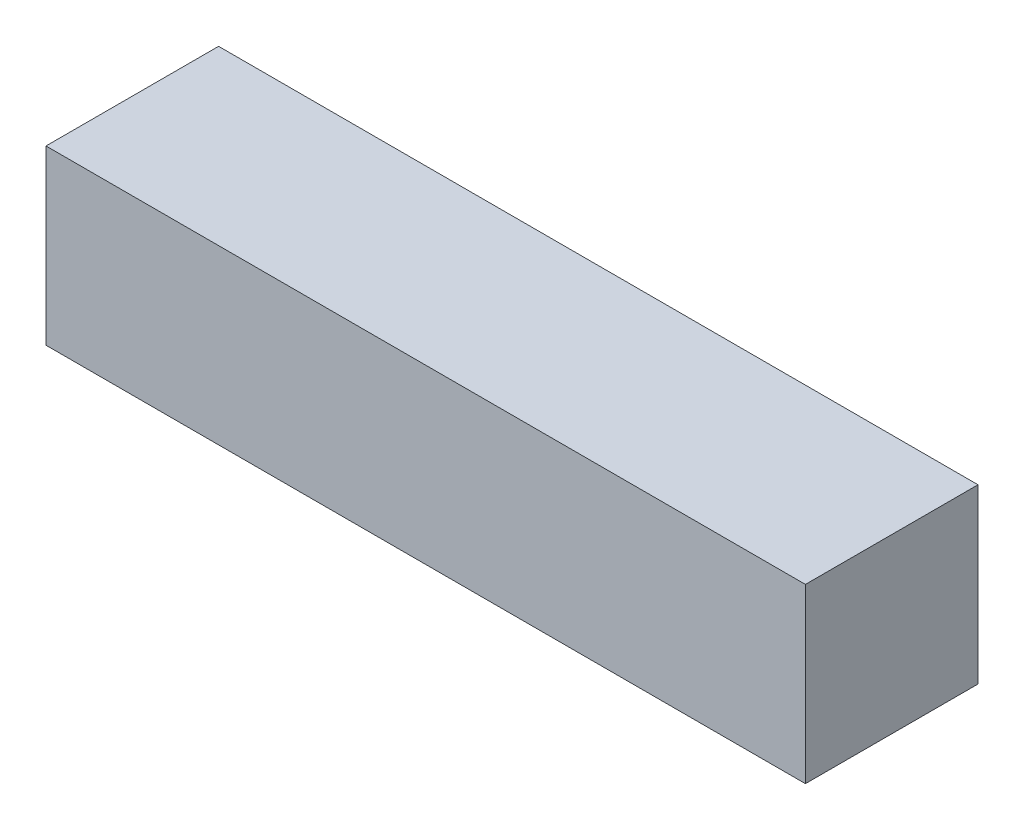
from build123d import *

# Parameters (mm, degrees)
ESQUISSE1_W        = 22
ESQUISSE1_H        = 5
BOSS_EXTRU_2_DEPTH = 5


with BuildPart() as part:
    # Esquisse1 → Boss.-Extru.2 (new body)
    with BuildSketch(Plane.XY):
        with Locations((-6.62368315, 10.418103448)):
            Rectangle(ESQUISSE1_W, ESQUISSE1_H)
    extrude(amount=BOSS_EXTRU_2_DEPTH)


solid = part.part
